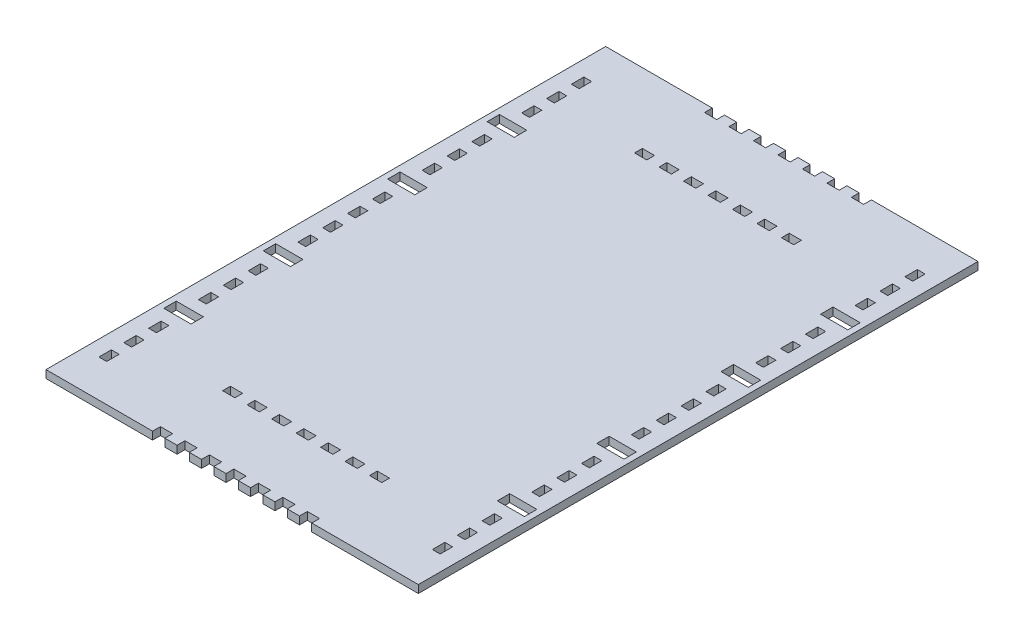
from build123d import *

# Parameters (mm, degrees)
SKETCH2_W           = 3.175
SKETCH2_H           = 5.08
SKETCH2_W_2         = 11.1125
SKETCH2_W_3         = 5
SKETCH2_H_2         = 3.175
BOSS_EXTRUDE1_DEPTH = 3.175


with BuildPart() as part:
    # Sketch2 → Boss-Extrude1 (new body)
    with BuildSketch(Plane(origin=(0, 0, 0), x_dir=(1, 0, 0), z_dir=(0, 1, 0))):
        Polygon((-64.926410988, -175.63059631), (-21.385160988, -175.63059631), (-21.385160988, -172.434057329), (-16.385160988, -172.434057329), (-16.385160988, -175.63059631), (-11.385160988, -175.63059631), (-11.385160988, -172.434057329), (-6.385160988, -172.434057329), (-6.385160988, -175.63059631), (-1.385160988, -175.63059631), (-1.385160988, -172.434057329), (3.614839012, -172.434057329), (3.614839012, -175.63059631), (8.614839012, -175.63059631), (8.614839012, -172.434057329), (13.614839012, -172.434057329), (13.614839012, -175.63059631), (18.614839012, -175.63059631), (18.614839012, -172.434057329), (23.614839012, -172.434057329), (23.614839012, -175.63059631), (28.614839012, -175.63059631), (28.614839012, -172.434057329), (33.614839012, -172.434057329), (33.614839012, -175.63059631), (38.614839012, -175.63059631), (38.614839012, -172.434057329), (43.614839012, -172.434057329), (43.614839012, -175.63059631), (87.156089012, -175.63059631), (87.156089012, -129.895859112), (87.156089012, -124.815859112), (87.156089012, -92.389420965), (87.156089012, -84.184928157), (87.156089012, -35.308693692), (87.156089012, -33.396264463), (87.156089012, -0.969826316), (87.156089012, 7.234666493), (87.156089012, 52.96940369), (43.614839012, 52.96940369), (43.614839012, 49.79440369), (38.614839012, 49.79440369), (38.614839012, 52.96940369), (33.614839012, 52.96940369), (33.614839012, 49.79440369), (28.614839012, 49.79440369), (28.614839012, 52.96940369), (23.614839012, 52.96940369), (23.614839012, 49.79440369), (18.614839012, 49.79440369), (18.614839012, 52.96940369), (13.614839012, 52.96940369), (13.614839012, 49.79440369), (8.614839012, 49.79440369), (8.614839012, 52.96940369), (3.614839012, 52.96940369), (3.614839012, 49.79440369), (-1.385160988, 49.79440369), (-1.385160988, 52.96940369), (-6.385160988, 52.96940369), (-6.385160988, 49.79440369), (-11.385160988, 49.79440369), (-11.385160988, 52.96940369), (-16.385160988, 52.96940369), (-16.385160988, 49.79440369), (-21.385160988, 49.79440369), (-21.385160988, 52.96940369), (-64.926410988, 52.96940369), (-64.926410988, 7.234666493), (-64.926410988, -0.969826316), (-64.926410988, -33.396264463), (-64.926410988, -35.308693692), (-64.926410988, -84.184928157), (-64.926410988, -92.389420965), (-64.926410988, -124.815859112), (-64.926410988, -129.895859112), align=None)
        with Locations((-56.988910988, -157.829057329)):
            Rectangle(SKETCH2_W, SKETCH2_H, mode=Mode.SUBTRACT)
        with Locations((79.218589012, -157.829057329)):
            Rectangle(SKETCH2_W, SKETCH2_H, mode=Mode.SUBTRACT)
        with Locations((-56.988910988, -147.67132459)):
            Rectangle(SKETCH2_W, SKETCH2_H, mode=Mode.SUBTRACT)
        with Locations((-56.988910988, -137.513591851)):
            Rectangle(SKETCH2_W, SKETCH2_H, mode=Mode.SUBTRACT)
        with Locations((79.218589012, -127.355859112)):
            Rectangle(SKETCH2_W_2, SKETCH2_H, mode=Mode.SUBTRACT)
        with Locations((-56.988910988, -117.198126373)):
            Rectangle(SKETCH2_W, SKETCH2_H, mode=Mode.SUBTRACT)
        with Locations((-56.988910988, -107.040393635)):
            Rectangle(SKETCH2_W, SKETCH2_H, mode=Mode.SUBTRACT)
        with Locations((-56.988910988, -96.882660896)):
            Rectangle(SKETCH2_W, SKETCH2_H, mode=Mode.SUBTRACT)
        with Locations((-56.988910988, -76.567195418)):
            Rectangle(SKETCH2_W, SKETCH2_H, mode=Mode.SUBTRACT)
        with Locations((-56.988910988, -66.409462679)):
            Rectangle(SKETCH2_W, SKETCH2_H, mode=Mode.SUBTRACT)
        with Locations((-56.988910988, -56.25172994)):
            Rectangle(SKETCH2_W, SKETCH2_H, mode=Mode.SUBTRACT)
        with Locations((-56.988910988, -46.093997201)):
            Rectangle(SKETCH2_W, SKETCH2_H, mode=Mode.SUBTRACT)
        with Locations((-56.988910988, -25.778531724)):
            Rectangle(SKETCH2_W, SKETCH2_H, mode=Mode.SUBTRACT)
        with Locations((-56.988910988, -15.620798985)):
            Rectangle(SKETCH2_W, SKETCH2_H, mode=Mode.SUBTRACT)
        with Locations((-56.988910988, -5.463066246)):
            Rectangle(SKETCH2_W, SKETCH2_H, mode=Mode.SUBTRACT)
        with Locations((-56.988910988, 14.852399232)):
            Rectangle(SKETCH2_W, SKETCH2_H, mode=Mode.SUBTRACT)
        with Locations((-56.988910988, 25.01013197)):
            Rectangle(SKETCH2_W, SKETCH2_H, mode=Mode.SUBTRACT)
        with Locations((-56.988910988, 35.167864709)):
            Rectangle(SKETCH2_W, SKETCH2_H, mode=Mode.SUBTRACT)
        with Locations((79.218589012, 35.167864709)):
            Rectangle(SKETCH2_W, SKETCH2_H, mode=Mode.SUBTRACT)
        with Locations((79.218589012, 25.01013197)):
            Rectangle(SKETCH2_W, SKETCH2_H, mode=Mode.SUBTRACT)
        with Locations((79.218589012, 14.852399232)):
            Rectangle(SKETCH2_W, SKETCH2_H, mode=Mode.SUBTRACT)
        with Locations((79.218589012, -35.936264463)):
            Rectangle(SKETCH2_W_2, SKETCH2_H, mode=Mode.SUBTRACT)
        Polygon((-62.545160988, -129.895859112), (-62.545160988, -124.815859112), (-51.432660988, -124.815859112), (-51.432660988, -129.895859112), (-55.401410988, -129.895859112), (-58.576410988, -129.895859112), align=None, mode=Mode.SUBTRACT)
        with Locations((79.218589012, -5.463066246)):
            Rectangle(SKETCH2_W, SKETCH2_H, mode=Mode.SUBTRACT)
        with Locations((79.218589012, -15.620798985)):
            Rectangle(SKETCH2_W, SKETCH2_H, mode=Mode.SUBTRACT)
        with Locations((79.218589012, -25.778531724)):
            Rectangle(SKETCH2_W, SKETCH2_H, mode=Mode.SUBTRACT)
        with Locations((-56.988910988, 4.694666493)):
            Rectangle(SKETCH2_W_2, SKETCH2_H, mode=Mode.SUBTRACT)
        with Locations((79.218589012, -86.724928157)):
            Rectangle(SKETCH2_W_2, SKETCH2_H, mode=Mode.SUBTRACT)
        with Locations((-56.988910988, -35.936264463)):
            Rectangle(SKETCH2_W_2, SKETCH2_H, mode=Mode.SUBTRACT)
        with Locations((79.218589012, -46.093997201)):
            Rectangle(SKETCH2_W, SKETCH2_H, mode=Mode.SUBTRACT)
        with Locations((79.218589012, -56.25172994)):
            Rectangle(SKETCH2_W, SKETCH2_H, mode=Mode.SUBTRACT)
        with Locations((79.218589012, -66.409462679)):
            Rectangle(SKETCH2_W, SKETCH2_H, mode=Mode.SUBTRACT)
        with Locations((79.218589012, -76.567195418)):
            Rectangle(SKETCH2_W, SKETCH2_H, mode=Mode.SUBTRACT)
        with Locations((-56.988910988, -86.724928157)):
            Rectangle(SKETCH2_W_2, SKETCH2_H, mode=Mode.SUBTRACT)
        with Locations((79.218589012, -96.882660896)):
            Rectangle(SKETCH2_W, SKETCH2_H, mode=Mode.SUBTRACT)
        with Locations((79.218589012, -107.040393635)):
            Rectangle(SKETCH2_W, SKETCH2_H, mode=Mode.SUBTRACT)
        with Locations((79.218589012, -117.198126373)):
            Rectangle(SKETCH2_W, SKETCH2_H, mode=Mode.SUBTRACT)
        with Locations((79.218589012, 4.694666493)):
            Rectangle(SKETCH2_W_2, SKETCH2_H, mode=Mode.SUBTRACT)
        with Locations((79.218589012, -137.513591851)):
            Rectangle(SKETCH2_W, SKETCH2_H, mode=Mode.SUBTRACT)
        with Locations((79.218589012, -147.67132459)):
            Rectangle(SKETCH2_W, SKETCH2_H, mode=Mode.SUBTRACT)
        with Locations((-18.875385123, 22.80690369)):
            Rectangle(SKETCH2_W_3, SKETCH2_H_2, mode=Mode.SUBTRACT)
        with Locations((-8.875385123, 22.80690369)):
            Rectangle(SKETCH2_W_3, SKETCH2_H_2, mode=Mode.SUBTRACT)
        with Locations((1.124614877, 22.80690369)):
            Rectangle(SKETCH2_W_3, SKETCH2_H_2, mode=Mode.SUBTRACT)
        with Locations((11.124614877, 22.80690369)):
            Rectangle(SKETCH2_W_3, SKETCH2_H_2, mode=Mode.SUBTRACT)
        with Locations((21.124614877, 22.80690369)):
            Rectangle(SKETCH2_W_3, SKETCH2_H_2, mode=Mode.SUBTRACT)
        with Locations((31.124614877, 22.80690369)):
            Rectangle(SKETCH2_W_3, SKETCH2_H_2, mode=Mode.SUBTRACT)
        with Locations((41.124614877, 22.80690369)):
            Rectangle(SKETCH2_W_3, SKETCH2_H_2, mode=Mode.SUBTRACT)
        with Locations((41.114839012, -145.446557329)):
            Rectangle(SKETCH2_W_3, SKETCH2_H_2, mode=Mode.SUBTRACT)
        with Locations((31.114839012, -145.446557329)):
            Rectangle(SKETCH2_W_3, SKETCH2_H_2, mode=Mode.SUBTRACT)
        with Locations((21.114839012, -145.446557329)):
            Rectangle(SKETCH2_W_3, SKETCH2_H_2, mode=Mode.SUBTRACT)
        with Locations((11.114839012, -145.446557329)):
            Rectangle(SKETCH2_W_3, SKETCH2_H_2, mode=Mode.SUBTRACT)
        with Locations((1.114839012, -145.446557329)):
            Rectangle(SKETCH2_W_3, SKETCH2_H_2, mode=Mode.SUBTRACT)
        with Locations((-8.885160988, -145.446557329)):
            Rectangle(SKETCH2_W_3, SKETCH2_H_2, mode=Mode.SUBTRACT)
        with Locations((-18.885160988, -145.446557329)):
            Rectangle(SKETCH2_W_3, SKETCH2_H_2, mode=Mode.SUBTRACT)
    extrude(amount=BOSS_EXTRUDE1_DEPTH)


solid = part.part
